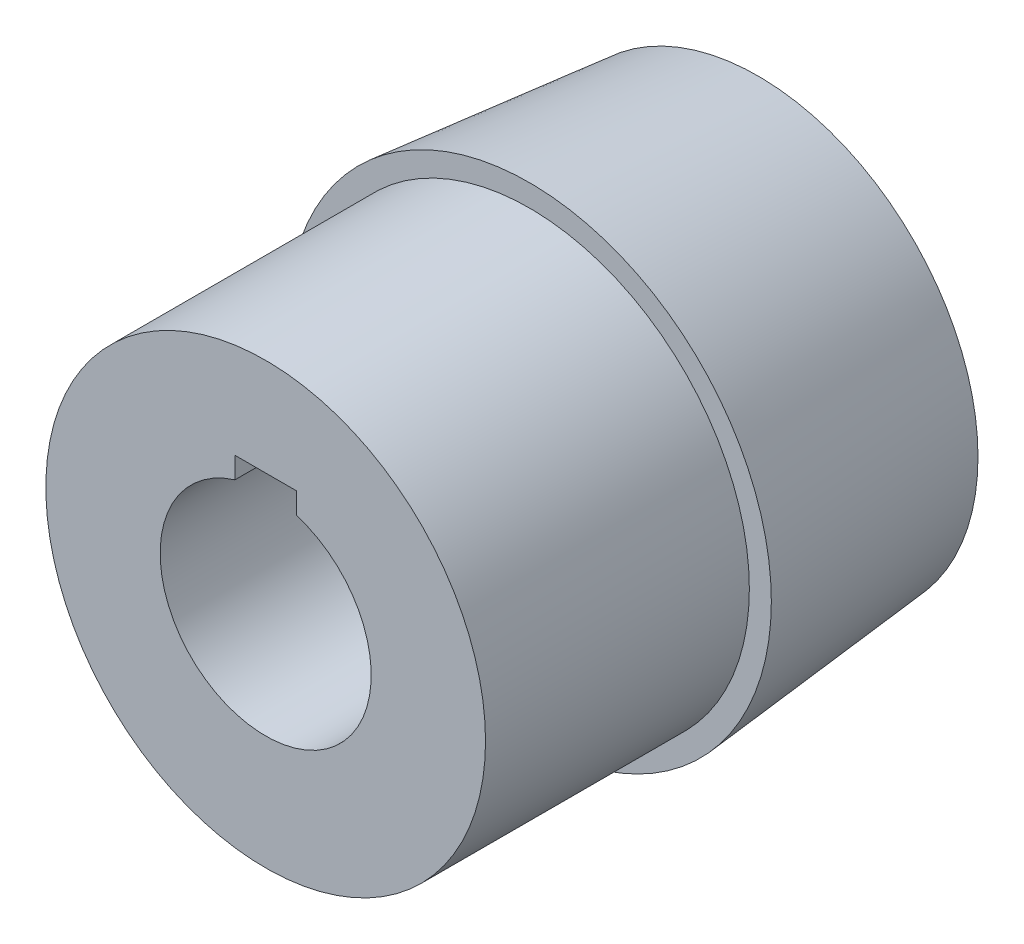
from build123d import *

# Parameters (mm, degrees)
SKETCH1_R                  = 55
BOSS_EXTRUDE1_DEPTH        = 56
SKETCH2_R                  = 24
CUT_EXTRUDE1_DEPTH         = 112
SKETCH3_W                  = 14
SKETCH3_H                  = 7.6
CUT_EXTRUDE2_DEPTH         = 137.359818128
SKETCH4_OUTSIDE_W          = 150.338
SKETCH4_OUTSIDE_H          = 150.338
SKETCH4_OUTSIDE_R          = 50
CUT_EXTRUDE3_DEPTH         = 60
M10X1_0_TAPPED_HOLE1_D     = 9
M10X1_0_TAPPED_HOLE1_DEPTH = 28
M10X1_0_TAPPED_HOLE1_TIP   = 2.703872786


with BuildPart() as part:
    # Sketch1 → Boss-Extrude1 (new, symmetric)
    with BuildSketch(Plane.XY):
        Circle(SKETCH1_R)
    extrude(amount=BOSS_EXTRUDE1_DEPTH, both=True)

    # Sketch2 → Cut-Extrude1 (cut)
    with BuildSketch(Plane.XY.offset(56)):
        Circle(SKETCH2_R)
    extrude(amount=-CUT_EXTRUDE1_DEPTH, mode=Mode.SUBTRACT)

    # Sketch3 → Cut-Extrude2 (cut, through all)
    with BuildSketch(Plane.XY.offset(56)):
        with Locations((0, 24)):
            Rectangle(SKETCH3_W, SKETCH3_H)
    extrude(amount=-CUT_EXTRUDE2_DEPTH, mode=Mode.SUBTRACT)

    # Sketch4 outside → Cut-Extrude3 (cut)
    with BuildSketch(Plane.XY.offset(56)):
        Rectangle(SKETCH4_OUTSIDE_W, SKETCH4_OUTSIDE_H)
        Circle(SKETCH4_OUTSIDE_R, mode=Mode.SUBTRACT)
    extrude(amount=-CUT_EXTRUDE3_DEPTH, mode=Mode.SUBTRACT)

    # Sketch5 → Cut-Revolve1 (revolve, cut)
    with BuildSketch(Plane(origin=(0, 0, 0), x_dir=(1, 0, 0), z_dir=(0, 1, 0))):
        Polygon((50, 56), (55, 4), (55, 56), align=None)
    revolve(axis=Axis((0, 0, 0), (0, 0, -1)), mode=Mode.SUBTRACT)

    # M10x1.0 Tapped Hole1
    with Locations(Plane(origin=(-4.867734964, -29.256831772, -56), x_dir=(1, 0, 0), z_dir=(0, 0, -1))):
        with Locations((41.867734964, -29.256831772), (-32.132265036, -29.256831772)):
            Hole(M10X1_0_TAPPED_HOLE1_D / 2, depth=M10X1_0_TAPPED_HOLE1_DEPTH)
            with Locations((0, 0, -(M10X1_0_TAPPED_HOLE1_DEPTH + M10X1_0_TAPPED_HOLE1_TIP / 2))):  # 118° drill point
                Cone(0, M10X1_0_TAPPED_HOLE1_D / 2, M10X1_0_TAPPED_HOLE1_TIP, mode=Mode.SUBTRACT)


solid = part.part
